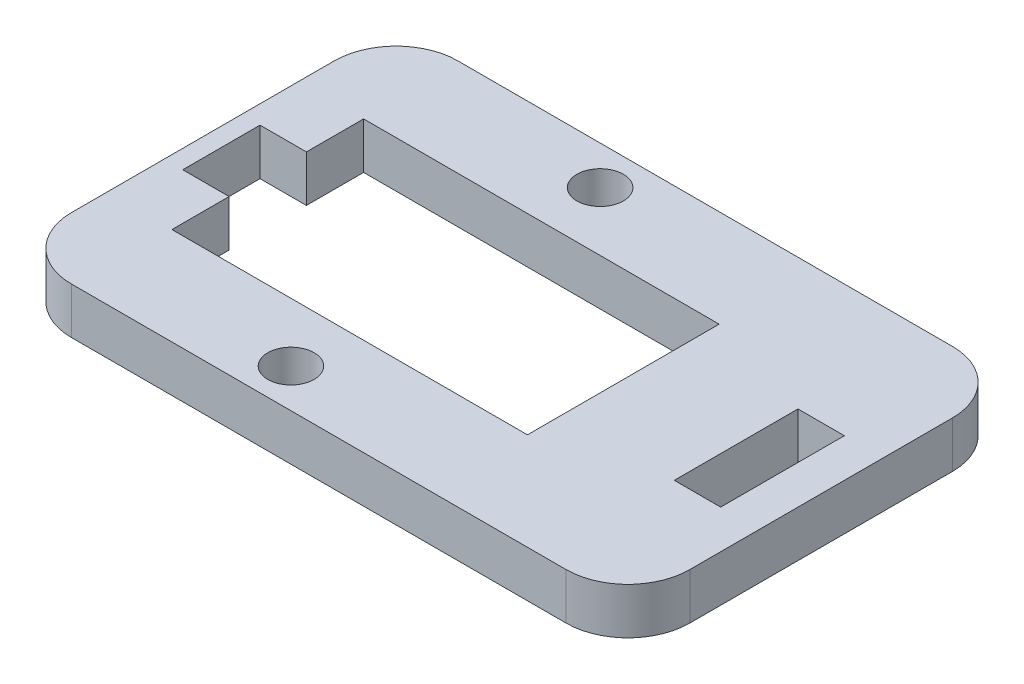
from build123d import *

# Parameters (mm, degrees)
ESBO_O1_W                  = 40
ESBO_O1_H                  = 25
RESSALTO_EXTRUS_O1_DEPTH   = 3
ESBO_O7_W                  = 3
ESBO_O7_H                  = 8
CORTE_EXTRUS_O3_DEPTH      = 43.014878317
PERFIL_CORTE_W             = 23
PERFIL_CORTE_H             = 12.4
CORTE_PRINCIPAL_DEPTH      = 76.288119648
FURO_DE_DI_METRO_3_0_3_1_D = 3
ESBO_O6_W                  = 3
ESBO_O6_H                  = 5
CORTE_EXTRUS_O2_DEPTH      = 92.50164688
FILETE1_R                  = 4


with BuildPart() as part:
    # Esboço1 → Ressalto-extrusão1 (new body)
    with BuildSketch(Plane(origin=(0, 0, 0), x_dir=(1, 0, 0), z_dir=(0, 1, 0))):
        with Locations((20, 0)):
            Rectangle(ESBO_O1_W, ESBO_O1_H)
    extrude(amount=RESSALTO_EXTRUS_O1_DEPTH)

    # Esboço7 → Corte-extrusão3 (cut, through all)
    with BuildSketch(Plane(origin=(0, 0, 0), x_dir=(1, 0, 0), z_dir=(0, 1, 0))):
        with Locations((36, 0)):
            Rectangle(ESBO_O7_W, ESBO_O7_H)
    extrude(amount=CORTE_EXTRUS_O3_DEPTH, mode=Mode.SUBTRACT)

    # Perfil Corte → Corte Principal (cut, through all)
    with BuildSketch(Plane(origin=(62.223874948, 0, 29.778722149), x_dir=(-1, 0, 0), z_dir=(0, -1, 0))):
        with Locations((46.523874948, 29.778722149)):
            Rectangle(PERFIL_CORTE_W, PERFIL_CORTE_H)
    extrude(amount=-CORTE_PRINCIPAL_DEPTH, mode=Mode.SUBTRACT)

    # Furo de diâmetro Ø3.0 (3)1 (through all)
    with Locations(Plane(origin=(84.444031263, 0, 22.610638925), x_dir=(-1, 0, 0), z_dir=(0, -1, 0))):
        with Locations((68.744031263, 32.610638925), (68.744031263, 12.610638925)):
            Hole(FURO_DE_DI_METRO_3_0_3_1_D / 2)

    # Esboço6 → Corte-extrusão2 (cut, through all)
    with BuildSketch(Plane(origin=(84.444031263, 0, 22.610638925), x_dir=(-1, 0, 0), z_dir=(0, -1, 0))):
        with Locations((81.744031263, 22.610638925)):
            Rectangle(ESBO_O6_W, ESBO_O6_H)
    extrude(amount=-CORTE_EXTRUS_O2_DEPTH, mode=Mode.SUBTRACT)

    # Filete1
    filete1_edges = [part.edges().sort_by_distance(p)[0] for p in [
        (0, 1.5, -12.5),
        (40, 1.5, -12.5),
        (40, 1.5, 12.5),
        (0, 1.5, 12.5),
    ]]
    fillet(filete1_edges, radius=FILETE1_R)


solid = part.part
